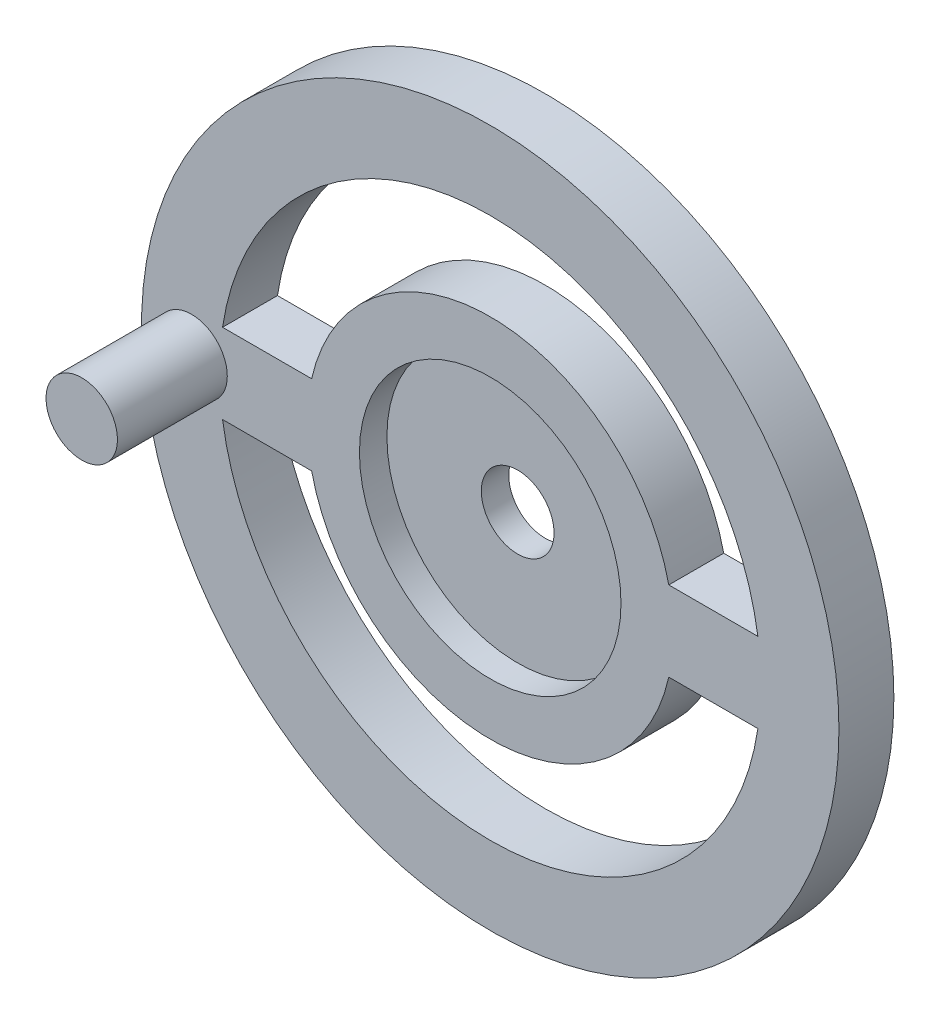
from build123d import *

# Parameters (mm, degrees)
SKETCH1_R           = 25.4
SKETCH1_R_2         = 2.65
BOSS_EXTRUDE1_DEPTH = 4
SKETCH2_R           = 2.6
BOSS_EXTRUDE2_DEPTH = 8
CUT_EXTRUDE2_START  = -2
SKETCH3_R           = 9.525
CUT_EXTRUDE2_DEPTH  = 10


with BuildPart() as part:
    # Sketch1 → Boss-Extrude1 (new body)
    with BuildSketch(Plane.XY):
        with Locations((674.616590385, -1255.036738659)):
            Circle(SKETCH1_R)
        with Locations((674.616590385, -1255.036738659)):
            Circle(SKETCH1_R_2, mode=Mode.SUBTRACT)
        with BuildLine():
            Line((661.61077501, -1252.128812685), (655.122370806, -1252.128812685))
            ThreePointArc((655.122370806, -1252.128812685), (674.616590385, -1235.326826673), (694.110809965, -1252.128812685))
            Line((694.110809965, -1252.128812685), (687.622405761, -1252.128812685))
            ThreePointArc((687.622405761, -1252.128812685), (674.616590385, -1241.709801012), (661.61077501, -1252.128812685))
        make_face(mode=Mode.SUBTRACT)
        with BuildLine():
            Line((661.61077501, -1257.944664633), (655.122370806, -1257.944664633))
            ThreePointArc((655.122370806, -1257.944664633), (674.616590385, -1274.746650645), (694.110809965, -1257.944664633))
            Line((694.110809965, -1257.944664633), (687.622405761, -1257.944664633))
            ThreePointArc((687.622405761, -1257.944664633), (674.616590385, -1268.363676307), (661.61077501, -1257.944664633))
        make_face(mode=Mode.SUBTRACT)
    extrude(amount=BOSS_EXTRUDE1_DEPTH)

    # Sketch2 → Boss-Extrude2 (add)
    with BuildSketch(Plane.XY.offset(4)):
        with Locations((652.866731087, -1255.036738659)):
            Circle(SKETCH2_R)
    extrude(amount=BOSS_EXTRUDE2_DEPTH)

    # Sketch3 → Cut-Extrude2 (cut)
    with BuildSketch(Plane(origin=(0, 0, 0), x_dir=(-1, 0, 0), z_dir=(0, 0, -1)).offset(CUT_EXTRUDE2_START)):
        with Locations((-674.616590385, -1255.036738659)):
            Circle(SKETCH3_R)
    extrude(amount=-CUT_EXTRUDE2_DEPTH, mode=Mode.SUBTRACT)


solid = part.part
